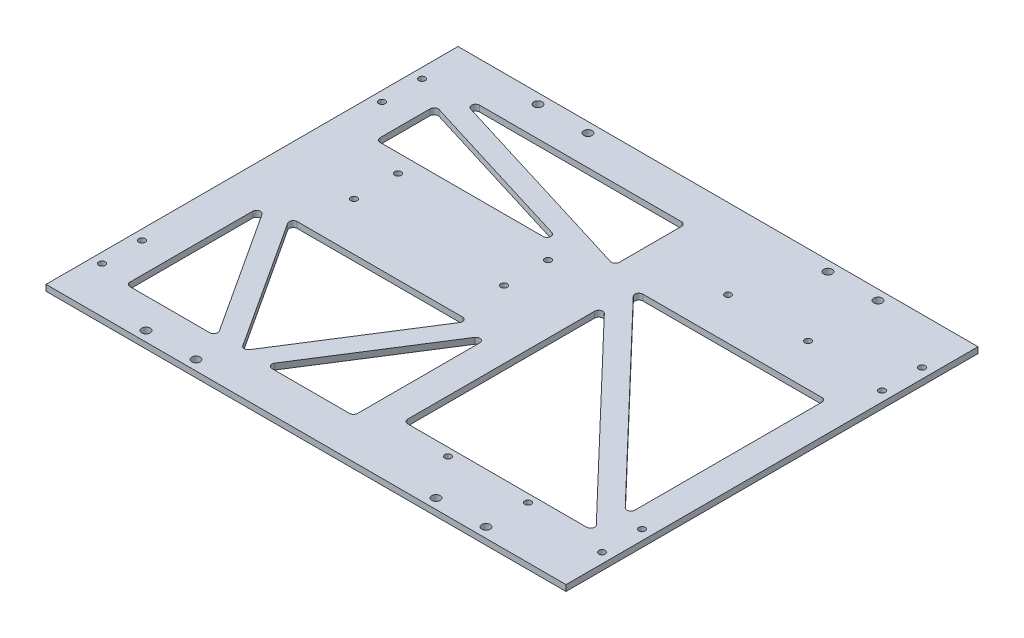
from build123d import *

# Parameters (mm, degrees)
SKETCH_1_W              = 260
SKETCH_1_H              = 206
EXTRUDE_1_DEPTH         = 3
HOLE_WIZARD_3_2_3_2_1_D = 3.2
HOLE_WIZARD_3_2_3_2_2_D = 3.2
HOLE_WIZARD_3_2_3_2_4_D = 3.2
HOLE_WIZARD_4_2_4_2_1_D = 4.2
MIRROR_2_COPY_1_D       = 4.2
CUT_EXTRUDE_1_DEPTH     = 244.608292141
FILLET_1_R              = 2


with BuildPart() as part:
    # 草图1 → 凸台-拉伸1 (new body)
    with BuildSketch(Plane(origin=(0, 0, 0), x_dir=(1, 0, 0), z_dir=(0, 1, 0))):
        with Locations((0, 103)):
            Rectangle(SKETCH_1_W, SKETCH_1_H)
    extrude(amount=EXTRUDE_1_DEPTH)

    # Ø3.2 (3.2) 直径孔1 (through all)
    with Locations(Plane(origin=(-15, 0, -136), x_dir=(0, 0, -1), z_dir=(0, -1, 0))):
        with Locations((0, 0), (-22, 0), (0, -75), (-22, -75)):
            Hole(HOLE_WIZARD_3_2_3_2_1_D / 2)

    # Ø3.2 (3.2) 直径孔2 (through all)
    with Locations(Plane(origin=(45, 0, -26), x_dir=(0, 0, -1), z_dir=(0, -1, 0))):
        with Locations((0, 0), (0, 40), (140, 0), (140, 40)):
            Hole(HOLE_WIZARD_3_2_3_2_2_D / 2)

    # Ø3.2 (3.2) 直径孔4 (through all)
    with Locations(Plane(origin=(-125, 0, -23), x_dir=(0, 0, -1), z_dir=(0, -1, 0))):
        with Locations((0, 0), (20, 0), (140, 0), (160, 0), (140, 250), (160, 250), (20, 250), (0, 250)):
            Hole(HOLE_WIZARD_3_2_3_2_4_D / 2)

    # Ø4.2 (4.2) 直径孔1 (through all)
    with Locations(Plane(origin=(-60, 0, -201), x_dir=(0, 0, -1), z_dir=(0, -1, 0))):
        with Locations((0, 0), (0, -25)):
            hole_wizard_4_2_4_2_1 = Hole(HOLE_WIZARD_4_2_4_2_1_D / 2)

    # 镜向1: Ø4.2 (4.2) 直径孔1 across plane
    add(hole_wizard_4_2_4_2_1.mirror(Plane(origin=(0, 0, 0), x_dir=(0, 0, 1), z_dir=(1, 0, 0))), mode=Mode.SUBTRACT)

    # 镜向2: Ø4.2 (4.2) 直径孔1 across plane
    add(hole_wizard_4_2_4_2_1.mirror(Plane.XY.offset(-103)), mode=Mode.SUBTRACT)

    # 镜向2 copy 1 (through all)
    with Locations(Plane(origin=(60, 0, -5), x_dir=(0, 0, 1), z_dir=(0, -1, 0))):
        with Locations((0, 0), (0, -25)):
            Hole(MIRROR_2_COPY_1_D / 2)

    # 草图11 → 切除-拉伸1 (cut, through all)
    with BuildSketch(Plane.XZ):
        Polygon((-110, -20), (-110, -90), (-64.432146014, -20), align=None)
        Polygon((-52.5, -20), (-98.067853986, -90), (-8.067853986, -90), align=None)
        Polygon((-40.655587213, -20), (3.776558802, -90), (3.776558802, -20), align=None)
        Polygon((18.776558802, -145), (115, -145), (115, -44.462623892), align=None)
        Polygon((-110, -145), (-13.228905706, -145), (-110, -174.76877079), align=None)
        Polygon((-112.49908843, -186), (3.776558802, -186), (3.776558802, -150.23122921), align=None)
        Polygon((18.776558802, -30), (18.776558802, -130.537376108), (115, -30), align=None)
    extrude(amount=-CUT_EXTRUDE_1_DEPTH, mode=Mode.SUBTRACT)

    # 圆角1
    fillet_1_edges = [part.edges().sort_by_distance(p)[0] for p in [
        (115, 1.5, -30),
        (18.776558802, 1.5, -130.537376108),
        (18.776558802, 1.5, -30),
        (18.776558802, 1.5, -145),
        (115, 1.5, -44.462623892),
        (115, 1.5, -145),
        (-110, 1.5, -174.76877079),
        (-110, 1.5, -145),
        (-13.228905706, 1.5, -145),
        (3.776558802, 1.5, -150.23122921),
        (3.776558802, 1.5, -186),
        (-112.49908843, 1.5, -186),
        (-52.5, 1.5, -20),
        (-8.067853986, 1.5, -90),
        (-98.067853986, 1.5, -90),
        (-40.655587213, 1.5, -20),
        (3.776558802, 1.5, -20),
        (3.776558802, 1.5, -90),
        (-110, 1.5, -20),
        (-64.432146014, 1.5, -20),
        (-110, 1.5, -90),
    ]]
    fillet(fillet_1_edges, radius=FILLET_1_R)


solid = part.part
